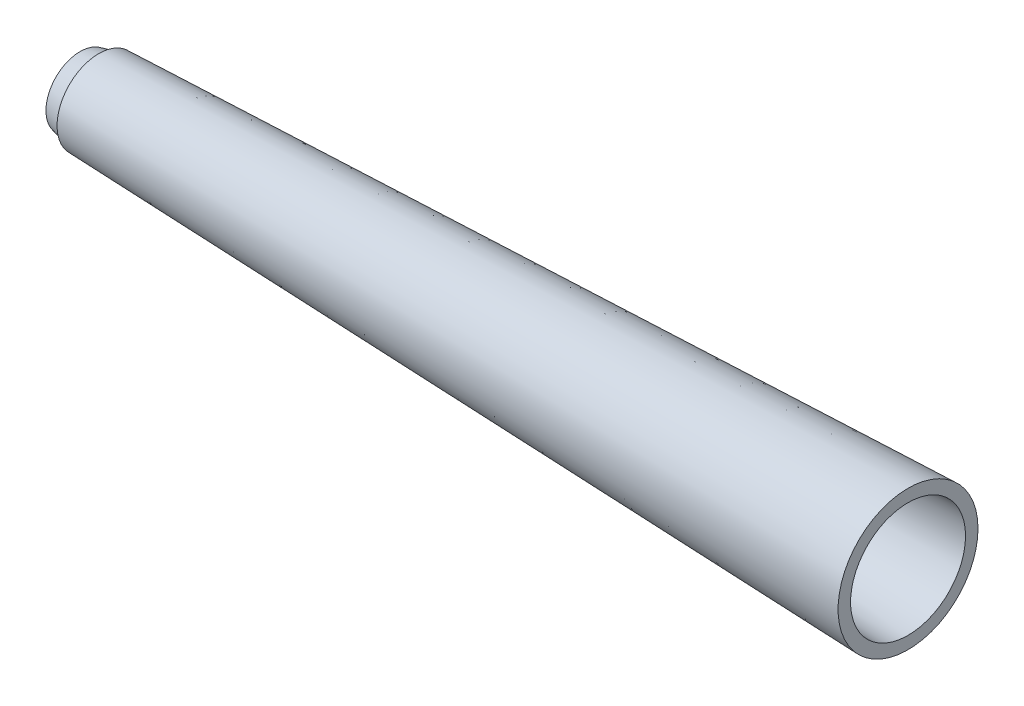
from build123d import *


with BuildPart() as part:
    # Sketch2 → Revolve2 (revolve)
    with BuildSketch(Plane.XY, mode=Mode.PRIVATE) as revolve2_sk:
        with BuildLine():
            Line((0, 1.2), (50, 4.696340597))
            Line((50, 4.696340597), (50, 6.696340597))
            Line((50, 6.696340597), (1.851094968, 3.32944117))
            ThreePointArc((1.851094968, 3.32944117), (0.484525778, 2.648094905), (0, 1.2))
        make_face()
    revolve(revolve2_sk.sketch.rotate(Axis((-19.275847123, 0, 0), (1, 0, 0)), 90), axis=Axis((-19.275847123, 0, 0), (1, 0, 0)))

    # Sketch3 → Revolve3 (revolve)
    with BuildSketch(Plane.XY, mode=Mode.PRIVATE) as revolve3_sk:
        Polygon((50, 4.695121509), (180, 9.234821543), (180, 11.236040631), (50, 6.696340597), align=None)
    revolve(revolve3_sk.sketch.rotate(Axis((50, 0, 0), (-1, 0, 0)), 90), axis=Axis((50, 0, 0), (-1, 0, 0)))

    # SurfaceCut3
    split(bisect_by=Plane(origin=(50, 0, 0), x_dir=(0, 0, -1), z_dir=(1, 0, 0)), keep=Keep.TOP)

    # Sketch4 → Revolve4 (revolve)
    with BuildSketch(Plane.XY, mode=Mode.PRIVATE) as revolve4_sk:
        Polygon((50, 6.195119648), (47, 5.484118263), (50, 5.196340597), align=None)
    revolve(revolve4_sk.sketch.rotate(Axis((50, 0, 0), (-1, 0, 0)), 90), axis=Axis((50, 0, 0), (-1, 0, 0)))


solid = part.part
